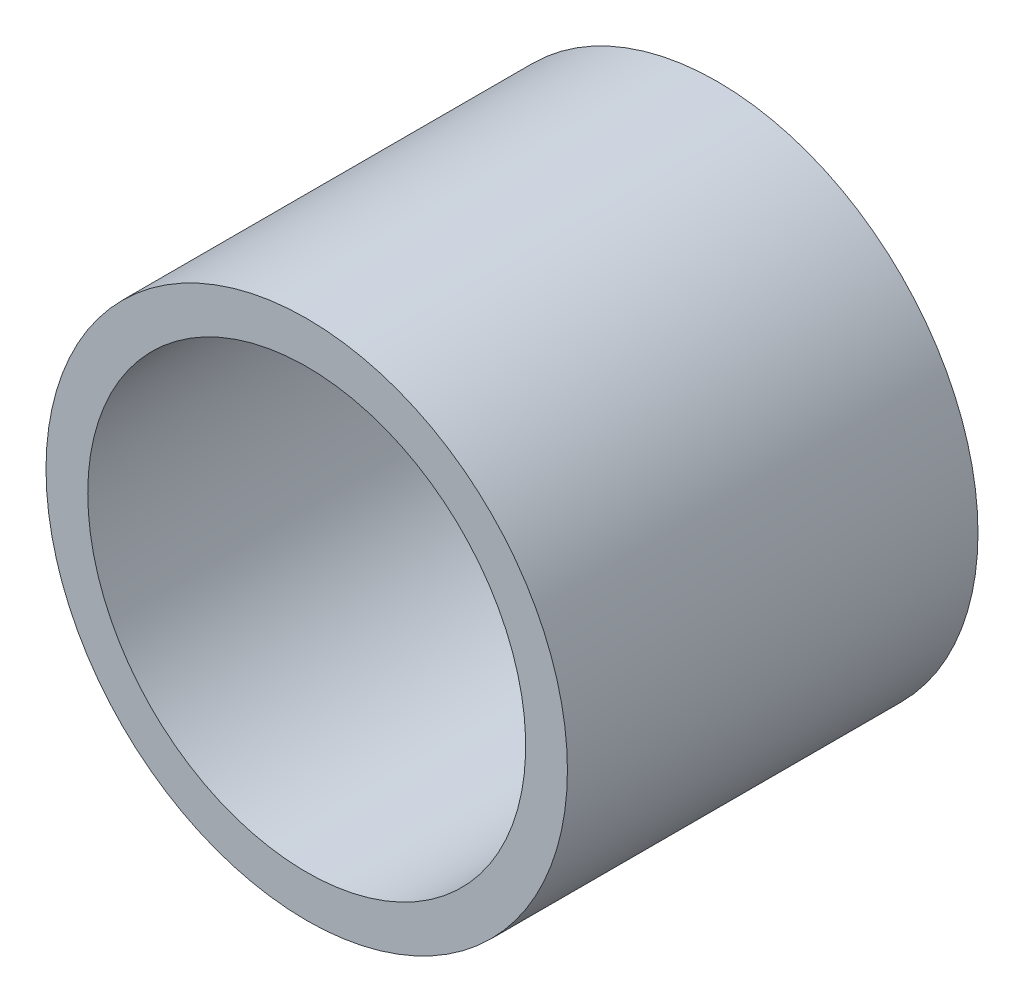
from build123d import *

# Parameters (mm, degrees)
SKETCH1_R           = 24.1935
SKETCH1_R_2         = 20.32
BOSS_EXTRUDE1_DEPTH = 38.1


with BuildPart() as part:
    # Sketch1 → Boss-Extrude1 (new body)
    with BuildSketch(Plane.XY):
        with Locations(Location((0, 0, 0), (0, 0, 180))):
            Circle(SKETCH1_R)
        with Locations(Location((0, 0, 0), (0, 0, 180))):
            Circle(SKETCH1_R_2, mode=Mode.SUBTRACT)
    extrude(amount=BOSS_EXTRUDE1_DEPTH)


solid = part.part
